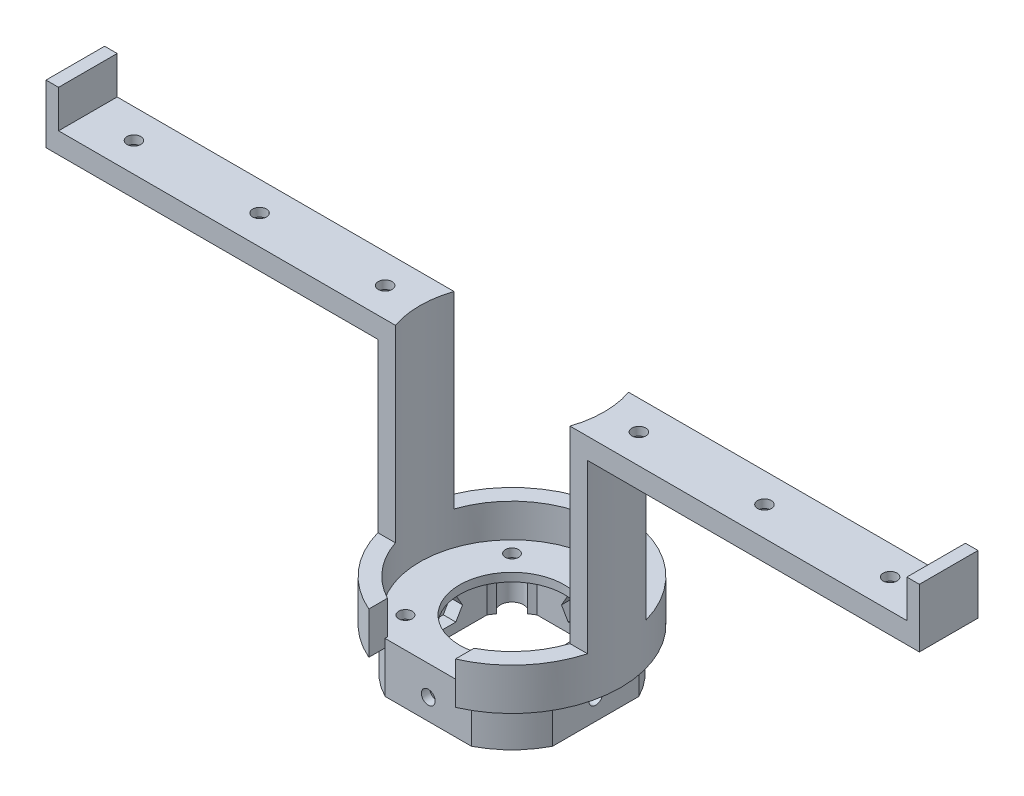
from build123d import *

# Parameters (mm, degrees)
SKETCH_1_R           = 1.6
EXTRUDE_1_DEPTH      = 2
SKETCH_2_R           = 12.5
CUT_EXTRUDE_1_DEPTH  = 3
SKETCH_5_R           = 26
SKETCH_5_R_2         = 22
EXTRUDE_3_DEPTH      = 10
EXTRUDE_5_DEPTH      = 10
SKETCH_15_R          = 1.65
CUT_EXTRUDE_2_DEPTH  = 42
SKETCH_16_R          = 1.65
CUT_EXTRUDE_3_DEPTH  = 42
CUT_EXTRUDE_4_DEPTH  = 18
CUT_EXTRUDE_5_DEPTH  = 18
EXTRUDE_6_DEPTH      = 45
SKETCH_24_W          = 50.26
SKETCH_24_H          = 14
EXTRUDE_7_DEPTH      = 5
SKETCH_25_R          = 1.65
CUT_EXTRUDE_6_DEPTH  = 5
CUT_EXTRUDE_7_DEPTH  = 3
CUT_EXTRUDE_9_DEPTH  = 10
CUT_EXTRUDE_START    = -8
CUT_EXTRUDE_10_DEPTH = 8
SKETCH_34_W          = 26
SKETCH_34_H          = 14
EXTRUDE_9_DEPTH      = 5
SKETCH_35_R          = 1.65
CUT_EXTRUDE_11_DEPTH = 5
CUT_EXTRUDE_12_DEPTH = 3
SKETCH_37_W          = 3
SKETCH_37_H          = 14
EXTRUDE_10_DEPTH     = 14


with BuildPart() as part:
    # 草图1 → 凸台-拉伸1 (new body)
    with BuildSketch(Plane(origin=(0, 0, 0), x_dir=(1, 0, 0), z_dir=(0, 1, 0))):
        with BuildLine():
            ThreePointArc((20.341082498, 8.380952381), (0, 22), (-20.341082498, 8.380952381))
            ThreePointArc((-20.341082498, 8.380952381), (-4.271778613, -21.581286048), (22, 0))
            ThreePointArc((22, 0), (21.581286048, 4.271778613), (20.341082498, 8.380952381))
        make_face()
        with Locations(Location((-12.727922061, -12.727922061, 0), (0, 0, 270))):
            Circle(SKETCH_1_R, mode=Mode.SUBTRACT)
        with Locations(Location((12.727922061, -12.727922061, 0), (0, 0, 270))):
            Circle(SKETCH_1_R, mode=Mode.SUBTRACT)
        with Locations(Location((-12.727922061, 12.727922061, 0), (0, 0, 270))):
            Circle(SKETCH_1_R, mode=Mode.SUBTRACT)
        with Locations(Location((12.727922061, 12.727922061, 0), (0, 0, 270))):
            Circle(SKETCH_1_R, mode=Mode.SUBTRACT)
    extrude(amount=EXTRUDE_1_DEPTH)

    # 草图2 → 切除-拉伸1 (cut)
    with BuildSketch(Plane(origin=(0, 2, 0), x_dir=(1, 0, 0), z_dir=(0, 1, 0))):
        with Locations(Location((0, 0, 0), (0, 0, 270))):
            Circle(SKETCH_2_R)
    extrude(amount=-CUT_EXTRUDE_1_DEPTH, mode=Mode.SUBTRACT)

    # 草图5 → 凸台-拉伸3 (add)
    with BuildSketch(Plane(origin=(0, 0, 0), x_dir=(1, 0, 0), z_dir=(0, 1, 0))):
        with Locations(Location((0, 0, 0), (0, 0, 270))):
            Circle(SKETCH_5_R)
        with Locations(Location((0, 0, 0), (0, 0, 270))):
            Circle(SKETCH_5_R_2, mode=Mode.SUBTRACT)
    extrude(amount=EXTRUDE_3_DEPTH)

    # 草图14 → 凸台-拉伸5 (add)
    with BuildSketch(Plane.XZ):
        with BuildLine():
            Line((-10.307764064, 20), (10.307764064, 20))
            ThreePointArc((10.307764064, 20), (15.909902577, 15.909902577), (20, 10.307764064))
            Line((20, 10.307764064), (20, -10.307764064))
            ThreePointArc((20, -10.307764064), (15.909902577, -15.909902577), (10.307764064, -20))
            Line((10.307764064, -20), (-10.307764064, -20))
            ThreePointArc((-10.307764064, -20), (-15.909902577, -15.909902577), (-20, -10.307764064))
            Line((-20, -10.307764064), (-20, 10.307764064))
            ThreePointArc((-20, 10.307764064), (-15.909902577, 15.909902577), (-10.307764064, 20))
        make_face()
        with BuildLine():
            Line((-9.013878189, 15), (9.013878189, 15))
            ThreePointArc((9.013878189, 15), (9.692559275, 14.570665555), (10.350828667, 14.110646544))
            ThreePointArc((10.350828667, 14.110646544), (14.67246571, 14.67246571), (14.110646544, 10.350828667))
            ThreePointArc((14.110646544, 10.350828667), (14.570665555, 9.692559275), (15, 9.013878189))
            Line((15, 9.013878189), (15, -9.013878189))
            ThreePointArc((15, -9.013878189), (14.570665555, -9.692559275), (14.110646544, -10.350828667))
            ThreePointArc((14.110646544, -10.350828667), (14.67246571, -14.67246571), (10.350828667, -14.110646544))
            ThreePointArc((10.350828667, -14.110646544), (9.692559275, -14.570665555), (9.013878189, -15))
            Line((9.013878189, -15), (-9.013878189, -15))
            ThreePointArc((-9.013878189, -15), (-9.692559275, -14.570665555), (-10.350828667, -14.110646544))
            ThreePointArc((-10.350828667, -14.110646544), (-14.67246571, -14.67246571), (-14.110646544, -10.350828667))
            ThreePointArc((-14.110646544, -10.350828667), (-14.570665555, -9.692559275), (-15, -9.013878189))
            Line((-15, -9.013878189), (-15, 9.013878189))
            ThreePointArc((-15, 9.013878189), (-14.570665555, 9.692559275), (-14.110646544, 10.350828667))
            ThreePointArc((-14.110646544, 10.350828667), (-14.67246571, 14.67246571), (-10.350828667, 14.110646544))
            ThreePointArc((-10.350828667, 14.110646544), (-9.692559275, 14.570665555), (-9.013878189, 15))
        make_face(mode=Mode.SUBTRACT)
    extrude(amount=EXTRUDE_5_DEPTH)

    # 草图15 → 切除-拉伸2 (cut)
    with BuildSketch(Plane.ZY.offset(20)):
        with Locations((0, -5)):
            Circle(SKETCH_15_R)
    extrude(amount=-CUT_EXTRUDE_2_DEPTH, mode=Mode.SUBTRACT)

    # 草图16 → 切除-拉伸3 (cut)
    with BuildSketch(Plane(origin=(0, 0, -20), x_dir=(-1, 0, 0), z_dir=(0, 0, -1))):
        with Locations((0, -5)):
            Circle(SKETCH_16_R)
    extrude(amount=-CUT_EXTRUDE_3_DEPTH, mode=Mode.SUBTRACT)

    # 草图18 → 切除-拉伸4 (cut, symmetric)
    with BuildSketch(Plane.XY):
        Polygon((-1.58771324, -2.25), (-3.175426481, -5), (-1.58771324, -7.75), (1.58771324, -7.75), (3.175426481, -5), (1.58771324, -2.25), align=None)
    extrude(amount=CUT_EXTRUDE_4_DEPTH, both=True, mode=Mode.SUBTRACT)

    # 草图19 → 切除-拉伸5 (cut, symmetric)
    with BuildSketch(Plane(origin=(0, 0, 0), x_dir=(0, 0, -1), z_dir=(1, 0, 0))):
        Polygon((-1.58771324, -2.25), (-3.175426481, -5), (-1.58771324, -7.75), (1.58771324, -7.75), (3.175426481, -5), (1.58771324, -2.25), align=None)
    extrude(amount=CUT_EXTRUDE_5_DEPTH, both=True, mode=Mode.SUBTRACT)

    # 草图23 → 凸台-拉伸6 (add)
    with BuildSketch(Plane(origin=(0, 10, 0), x_dir=(1, 0, 0), z_dir=(0, 1, 0))):
        with BuildLine():
            ThreePointArc((-22, 0), (-21.712282003, 3.546379878), (-20.856653615, 7))
            Line((-20.856653615, 7), (-25.039968051, 7))
            ThreePointArc((-25.039968051, 7), (-25.758873901, 3.53276313), (-26, 0))
            Line((-26, 0), (-22, 0))
        make_face()
        with BuildLine():
            ThreePointArc((-20.856653615, -7), (-21.712282003, -3.546379878), (-22, 0))
            Line((-22, 0), (-26, 0))
            ThreePointArc((-26, 0), (-25.758873901, -3.53276313), (-25.039968051, -7))
            Line((-25.039968051, -7), (-20.856653615, -7))
        make_face()
        with BuildLine():
            Line((25.039968051, 7), (20.856653615, 7))
            ThreePointArc((20.856653615, 7), (21.712282003, 3.546379878), (22, 0))
            Line((22, 0), (26, 0))
            ThreePointArc((26, 0), (25.758873901, 3.53276313), (25.039968051, 7))
        make_face()
        with BuildLine():
            Line((26, 0), (22, 0))
            ThreePointArc((22, 0), (21.712282003, -3.546379878), (20.856653615, -7))
            Line((20.856653615, -7), (25.039968051, -7))
            ThreePointArc((25.039968051, -7), (25.758873901, -3.53276313), (26, 0))
        make_face()
    extrude(amount=EXTRUDE_6_DEPTH)

    # 草图24 → 凸台-拉伸7 (add)
    with BuildSketch(Plane(origin=(0, 55, 0), x_dir=(1, 0, 0), z_dir=(0, 1, 0))):
        with Locations((-50.169968051, 0)):
            Rectangle(SKETCH_24_W, SKETCH_24_H)
    extrude_7 = extrude(amount=-EXTRUDE_7_DEPTH)

    # 镜向1: 凸台-拉伸7 across plane
    add(extrude_7.mirror(Plane(origin=(0, 0, 0), x_dir=(0, 0, 1), z_dir=(1, 0, 0))))

    # 草图25 → 切除-拉伸6 (cut)
    with BuildSketch(Plane(origin=(0, 55, 0), x_dir=(1, 0, 0), z_dir=(0, 1, 0))):
        with Locations(Location((-60.299968051, 0, 0), (0, 0, 270))):
            Circle(SKETCH_25_R)
        with Locations(Location((-30.299968051, 0, 0), (0, 0, 270))):
            Circle(SKETCH_25_R)
    cut_extrude_6 = extrude(amount=-CUT_EXTRUDE_6_DEPTH, mode=Mode.SUBTRACT)

    # 草图26 → 切除-拉伸7 (cut)
    with BuildSketch(Plane(origin=(0, 50, 0), x_dir=(1, 0, 0), z_dir=(0, 1, 0))):
        Polygon((-58.712254811, 2.75), (-61.887681291, 2.75), (-63.475394532, 0), (-61.887681291, -2.75), (-58.712254811, -2.75), (-57.124541571, 0), align=None)
        Polygon((-31.887681291, 2.75), (-33.475394532, 0), (-31.887681291, -2.75), (-28.712254811, -2.75), (-27.124541571, 0), (-28.712254811, 2.75), align=None)
    cut_extrude_7 = extrude(amount=CUT_EXTRUDE_7_DEPTH, mode=Mode.SUBTRACT)

    # 镜向3: 切除-拉伸6, 切除-拉伸7 across plane
    add(cut_extrude_6.mirror(Plane(origin=(0, 0, 0), x_dir=(0, 0, 1), z_dir=(1, 0, 0))), mode=Mode.SUBTRACT)
    add(cut_extrude_7.mirror(Plane(origin=(0, 0, 0), x_dir=(0, 0, 1), z_dir=(1, 0, 0))), mode=Mode.SUBTRACT)

    # 草图28 → 切除-拉伸9 (cut)
    with BuildSketch(Plane.XZ):
        with BuildLine():
            Line((-10.34, 20), (10.34, 20))
            Line((10.34, 20), (10.34, 23.855489934))
            ThreePointArc((10.34, 23.855489934), (0, 26), (-10.34, 23.855489934))
            Line((-10.34, 23.855489934), (-10.34, 20))
        make_face()
    extrude(amount=-CUT_EXTRUDE_9_DEPTH, mode=Mode.SUBTRACT)

    # 草图29 → 切除-拉伸10 (cut)
    with BuildSketch(Plane(origin=(0, 10, 0), x_dir=(1, 0, 0), z_dir=(0, 1, 0)).offset(CUT_EXTRUDE_START)):
        with BuildLine():
            Line((-10.34, -20), (-10.34, -19.418661128))
            ThreePointArc((-10.34, -19.418661128), (-9.756906344, -19.718082528), (-9.16515139, -20))
            Line((-9.16515139, -20), (-10.34, -20))
        make_face()
        with BuildLine():
            Line((10.34, -20), (10.34, -19.418661128))
            ThreePointArc((10.34, -19.418661128), (9.756906344, -19.718082528), (9.16515139, -20))
            Line((9.16515139, -20), (10.34, -20))
        make_face()
    extrude(amount=CUT_EXTRUDE_10_DEPTH, mode=Mode.SUBTRACT)

    # 草图34 → 凸台-拉伸9 (add)
    with BuildSketch(Plane.XZ.offset(-50)):
        with Locations((-88.299968051, 0)):
            Rectangle(SKETCH_34_W, SKETCH_34_H)
        with Locations((88.299968051, 0)):
            Rectangle(SKETCH_34_W, SKETCH_34_H)
    extrude(amount=-EXTRUDE_9_DEPTH)

    # 草图35 → 切除-拉伸11 (cut)
    with BuildSketch(Plane(origin=(0, 55, 0), x_dir=(1, 0, 0), z_dir=(0, 1, 0))):
        with Locations(Location((-90.299968051, 0, 0), (0, 0, 270))):
            Circle(SKETCH_35_R)
        with Locations(Location((90.299968051, 0, 0), (0, 0, 270))):
            Circle(SKETCH_35_R)
    extrude(amount=-CUT_EXTRUDE_11_DEPTH, mode=Mode.SUBTRACT)

    # 草图36 → 切除-拉伸12 (cut)
    with BuildSketch(Plane.XZ.offset(-50)):
        Polygon((-91.887681291, 2.75), (-93.475394532, 0), (-91.887681291, -2.75), (-88.712254811, -2.75), (-87.124541571, 0), (-88.712254811, 2.75), align=None)
        Polygon((91.887681291, 2.75), (88.712254811, 2.75), (87.124541571, 0), (88.712254811, -2.75), (91.887681291, -2.75), (93.475394532, 0), align=None)
    extrude(amount=-CUT_EXTRUDE_12_DEPTH, mode=Mode.SUBTRACT)

    # 草图37 → 凸台-拉伸10 (add)
    with BuildSketch(Plane.XZ.offset(-50)):
        with Locations((-102.799968051, 0)):
            Rectangle(SKETCH_37_W, SKETCH_37_H)
        with Locations((102.799968051, 0)):
            Rectangle(SKETCH_37_W, SKETCH_37_H)
    extrude(amount=-EXTRUDE_10_DEPTH)


solid = part.part
